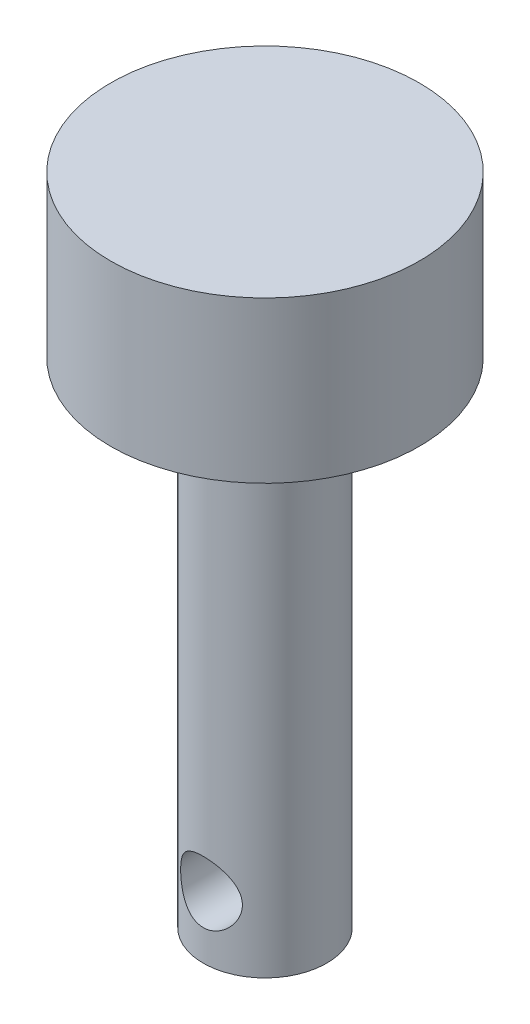
from build123d import *

# Parameters (mm, degrees)
CUT_EXTRUDE1_DEPTH      = 10
CUT_EXTRUDE1_DEPTH_BACK = 10
SKETCH2_R               = 2.5


with BuildPart() as part:
    # Sketch1 → Revolve1 (revolve)
    with BuildSketch(Plane.XY):
        Polygon((0, 0), (0, 53), (12.5, 53), (12.5, 40), (5, 40), (5, 0), align=None)
    revolve(axis=Axis((0, 0, 0), (0, 1, 0)))

    # Sketch2 → Cut-Extrude1 (cut, two sides: drawn at the far end of the back side and taken through both)
    with BuildSketch(Plane.XY.offset(-CUT_EXTRUDE1_DEPTH_BACK)):
        with Locations((0, 5)):
            Circle(SKETCH2_R)
    extrude(amount=CUT_EXTRUDE1_DEPTH + CUT_EXTRUDE1_DEPTH_BACK, mode=Mode.SUBTRACT)


solid = part.part
